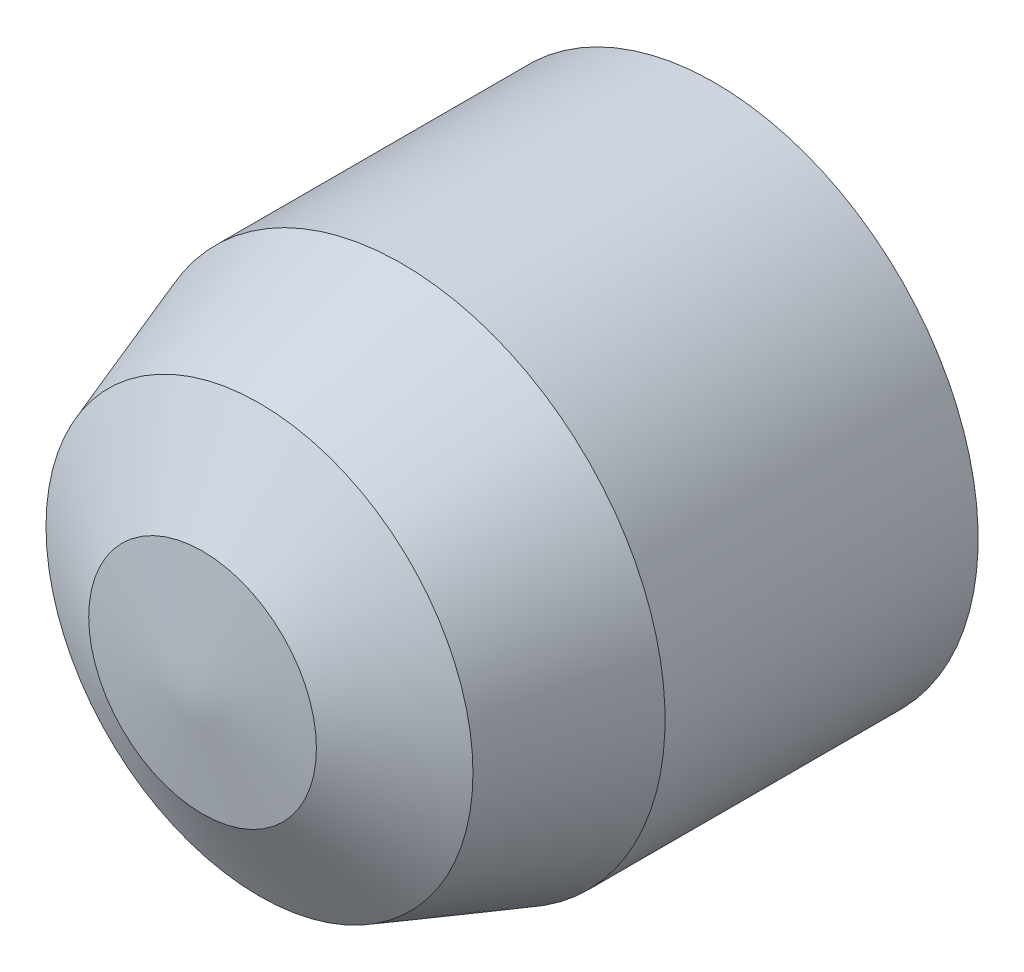
from build123d import *


with BuildPart() as part:
    # Revolve profile 1 → Revolve 1 (revolve)
    with BuildSketch(Plane(origin=(0, 225, 0), x_dir=(1, 0, 0), z_dir=(0, 1, 0)), mode=Mode.PRIVATE) as revolve_1_sk:
        Polygon((860, -896), (860, -822), (897, -822), (897, -866), (890, -886), (876, -894), align=None)
    revolve(revolve_1_sk.sketch.rotate(Axis((860, 225, 817), (0, 0, 1)), 180), axis=Axis((860, 225, 817), (0, 0, 1)))


solid = part.part
